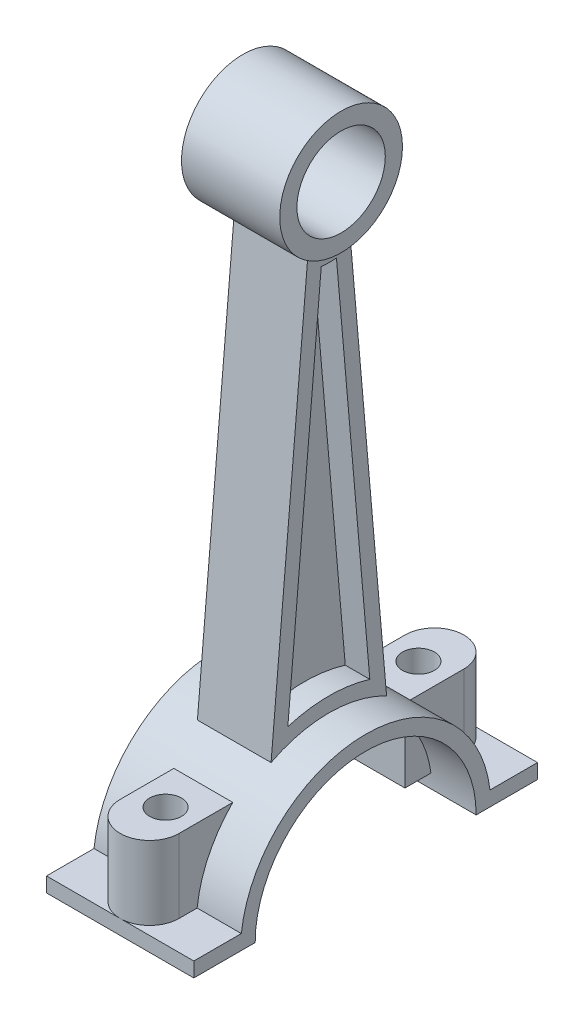
from build123d import *

# Parameters (mm, degrees)
SKETCH3_R           = 9
BOSS_EXTRUDE2_DEPTH = 10
BOSS_EXTRUDE3_DEPTH = 15
BOSS_EXTRUDE4_DEPTH = 7.5
BOSS_EXTRUDE5_DEPTH = 15
SKETCH5_R           = 3.25
CUT_EXTRUDE1_DEPTH  = 122.045487318
CUT_EXTRUDE3_DEPTH  = 5


with BuildPart() as part:
    # Sketch3 → Boss-Extrude2 (new, symmetric)
    with BuildSketch(Plane(origin=(0, 0, 0), x_dir=(0, 0, -1), z_dir=(1, 0, 0))):
        with BuildLine():
            ThreePointArc((-4.237325504, 30.810381037), (0, 30.070273578), (4.237325504, 30.810381037))
            ThreePointArc((4.237325504, 30.810381037), (10.227819142, 35.38405652), (12.5, 42.570273578))
            ThreePointArc((12.5, 42.570273578), (-7.186217058, 52.79809272), (-4.237325504, 30.810381037))
        make_face()
        with Locations((0, 42.570273578)):
            Circle(SKETCH3_R, mode=Mode.SUBTRACT)
    extrude(amount=BOSS_EXTRUDE2_DEPTH, both=True)



with BuildPart() as body_2:
    # Sketch3<4> → Boss-Extrude3 (new, symmetric)
    with BuildSketch(Plane(origin=(0, 0, 0), x_dir=(0, 0, -1), z_dir=(1, 0, 0))):
        with BuildLine():
            Line((-25.322914524, -74.829726422), (-35, -74.829726422))
            Line((-35, -74.829726422), (-35, -77.829726422))
            Line((-35, -77.829726422), (-22.5, -77.829726422))
            ThreePointArc((-22.5, -77.829726422), (0, -55.329726422), (22.5, -77.829726422))
            Line((22.5, -77.829726422), (35, -77.829726422))
            Line((35, -77.829726422), (35, -74.829726422))
            Line((35, -74.829726422), (25.322914524, -74.829726422))
            ThreePointArc((25.322914524, -74.829726422), (0, -52.329726422), (-25.322914524, -74.829726422))
        make_face()
    extrude(amount=BOSS_EXTRUDE3_DEPTH, both=True)


with BuildPart() as part_1:
    add(part.part)

    add(body_2.part)  # Boss-Extrude4 merges body 2
    # Sketch3<5> → Boss-Extrude4 (add, symmetric)
    with BuildSketch(Plane(origin=(0, 0, 0), x_dir=(0, 0, -1), z_dir=(1, 0, 0))):
        with BuildLine():
            ThreePointArc((4.237325504, 30.810381037), (0, 30.070273578), (-4.237325504, 30.810381037))
            Line((-4.237325504, 30.810381037), (-11.762674496, -55.204751534))
            ThreePointArc((-11.762674496, -55.204751534), (0, -52.329726422), (11.762674496, -55.204751534))
            Line((11.762674496, -55.204751534), (4.237325504, 30.810381037))
        make_face()
    extrude(amount=BOSS_EXTRUDE4_DEPTH, both=True)

    # Sketch4 → Boss-Extrude5 (add)
    with BuildSketch(Plane(origin=(0, -74.829726422, 0), x_dir=(1, 0, 0), z_dir=(0, 1, 0))):
        with BuildLine():
            ThreePointArc((6, 29), (0, 35), (-6, 29))
            Line((-6, 29), (-6, 17))
            Line((-6, 17), (6, 17))
            Line((6, 17), (6, 29))
        make_face()
    boss_extrude5 = extrude(amount=BOSS_EXTRUDE5_DEPTH)

    # Sketch5 → Cut-Extrude1 (cut, through all)
    with BuildSketch(Plane(origin=(0, -59.829726422, 0), x_dir=(1, 0, 0), z_dir=(0, 1, 0))):
        with Locations((0, 25.75)):
            Circle(SKETCH5_R)
    cut_extrude1 = extrude(amount=-CUT_EXTRUDE1_DEPTH, mode=Mode.SUBTRACT)

    # Mirror1: Boss-Extrude5, Cut-Extrude1 across plane
    add(boss_extrude5.mirror(Plane.XY))
    add(cut_extrude1.mirror(Plane.XY), mode=Mode.SUBTRACT)

    # Sketch9 → Cut-Extrude3 (cut)
    with BuildSketch(Plane.ZY.offset(7.5)):
        with BuildLine():
            ThreePointArc((1.546317924, 27.147598684), (0, 27.070273578), (-1.546317924, 27.147598684))
            Line((-1.546317924, 27.147598684), (-8.346541197, -50.579308993))
            ThreePointArc((-8.346541197, -50.579308993), (0, -49.329726422), (8.346541197, -50.579308993))
            Line((8.346541197, -50.579308993), (1.546317924, 27.147598684))
        make_face()
    cut_extrude3 = extrude(amount=-CUT_EXTRUDE3_DEPTH, mode=Mode.SUBTRACT)

    # Mirror2: Cut-Extrude3 across plane
    add(cut_extrude3.mirror(Plane(origin=(0, 0, 0), x_dir=(0, 0, 1), z_dir=(1, 0, 0))), mode=Mode.SUBTRACT)


solid = part_1.part
